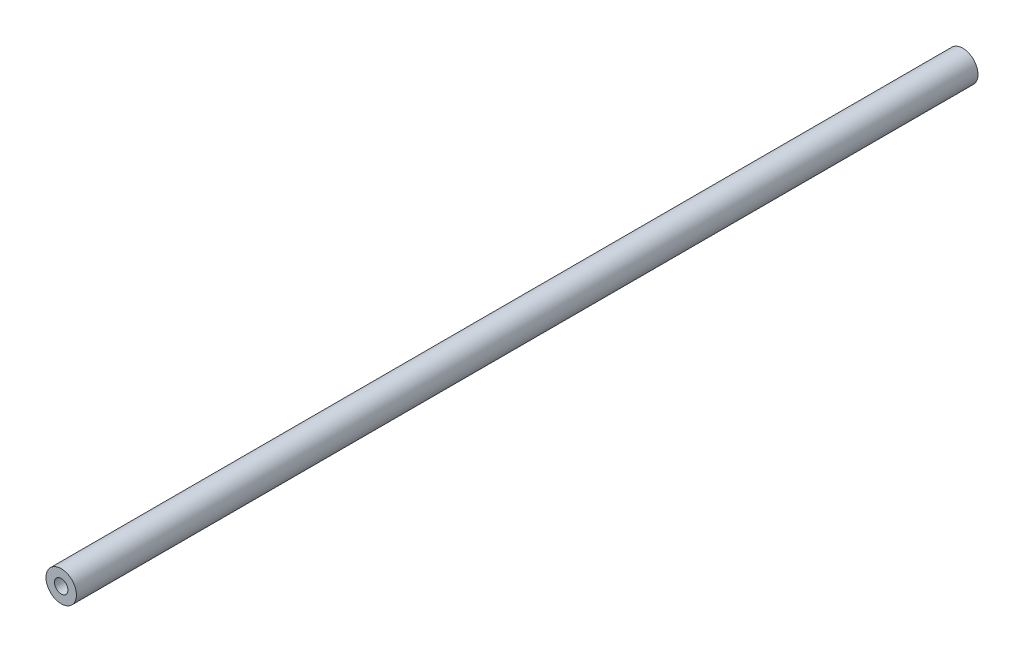
from build123d import *

# Parameters (mm, degrees)
SKETCH1_R                       = 3.96875
BOSS_EXTRUDE1_DEPTH             = 117.475
F_6_32_TAPPED_HOLE1_D           = 2.7051
F_6_32_TAPPED_HOLE1_DEPTH       = 9.398
F_6_32_TAPPED_HOLE1_CBORE_D     = 3.5052
F_6_32_TAPPED_HOLE1_CBORE_DEPTH = 7.112
F_6_32_TAPPED_HOLE1_TIP         = 0.81269403
F_6_32_TAPPED_HOLE2_D           = 2.7051
F_6_32_TAPPED_HOLE2_DEPTH       = 9.398
F_6_32_TAPPED_HOLE2_CBORE_D     = 3.5052
F_6_32_TAPPED_HOLE2_CBORE_DEPTH = 7.112
F_6_32_TAPPED_HOLE2_TIP         = 0.81269403


with BuildPart() as part:
    # Sketch1 → Boss-Extrude1 (new, symmetric)
    with BuildSketch(Plane.XY):
        Circle(SKETCH1_R)
    extrude(amount=BOSS_EXTRUDE1_DEPTH, both=True)

    # #6-32 Tapped Hole1
    with Locations(Plane(origin=(0, 0, -117.475), x_dir=(-1, 0, 0), z_dir=(0, 0, -1))):
        with Locations((0, 0)):
            CounterBoreHole(F_6_32_TAPPED_HOLE1_D / 2, F_6_32_TAPPED_HOLE1_CBORE_D / 2, F_6_32_TAPPED_HOLE1_CBORE_DEPTH, depth=F_6_32_TAPPED_HOLE1_DEPTH)
            with Locations((0, 0, -(F_6_32_TAPPED_HOLE1_DEPTH + F_6_32_TAPPED_HOLE1_TIP / 2))):  # 118° drill point
                Cone(0, F_6_32_TAPPED_HOLE1_D / 2, F_6_32_TAPPED_HOLE1_TIP, mode=Mode.SUBTRACT)

    # #6-32 Tapped Hole2
    with Locations(Plane.XY.offset(117.475)):
        with Locations((0, 0)):
            CounterBoreHole(F_6_32_TAPPED_HOLE2_D / 2, F_6_32_TAPPED_HOLE2_CBORE_D / 2, F_6_32_TAPPED_HOLE2_CBORE_DEPTH, depth=F_6_32_TAPPED_HOLE2_DEPTH)
            with Locations((0, 0, -(F_6_32_TAPPED_HOLE2_DEPTH + F_6_32_TAPPED_HOLE2_TIP / 2))):  # 118° drill point
                Cone(0, F_6_32_TAPPED_HOLE2_D / 2, F_6_32_TAPPED_HOLE2_TIP, mode=Mode.SUBTRACT)


solid = part.part
